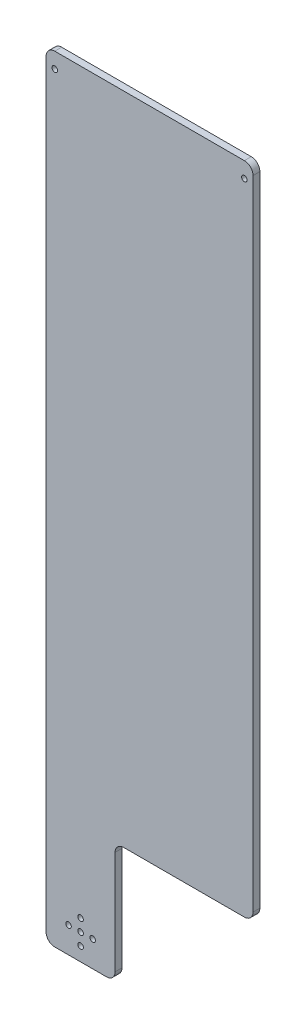
from build123d import *

# Parameters (mm, degrees)
SKETCH_2_R      = 1.6
EXTRUDE_1_DEPTH = 4
FILLET_1_R      = 5


with BuildPart() as part:
    # 草图2 → 凸台-拉伸1 (new body)
    with BuildSketch(Plane.XY):
        Polygon((0, 0), (40, 0), (40, 70), (120, 70), (120, 450), (40, 450), (0, 450), align=None)
        with Locations((20, 8)):
            Circle(SKETCH_2_R, mode=Mode.SUBTRACT)
        with Locations((20, 22)):
            Circle(SKETCH_2_R, mode=Mode.SUBTRACT)
        with Locations((27, 15)):
            Circle(SKETCH_2_R, mode=Mode.SUBTRACT)
        with Locations((13, 15)):
            Circle(SKETCH_2_R, mode=Mode.SUBTRACT)
        with Locations((20, 15)):
            Circle(SKETCH_2_R, mode=Mode.SUBTRACT)
        with Locations((115, 441)):
            Circle(SKETCH_2_R, mode=Mode.SUBTRACT)
        with Locations((5, 441)):
            Circle(SKETCH_2_R, mode=Mode.SUBTRACT)
    extrude(amount=EXTRUDE_1_DEPTH)

    # 圆角1
    fillet_1_edges = [part.edges().sort_by_distance(p)[0] for p in [
        (0, 450, 2),
        (120, 450, 2),
        (120, 70, 2),
        (40, 70, 2),
        (40, 0, 2),
        (0, 0, 2),
    ]]
    fillet(fillet_1_edges, radius=FILLET_1_R)


solid = part.part
